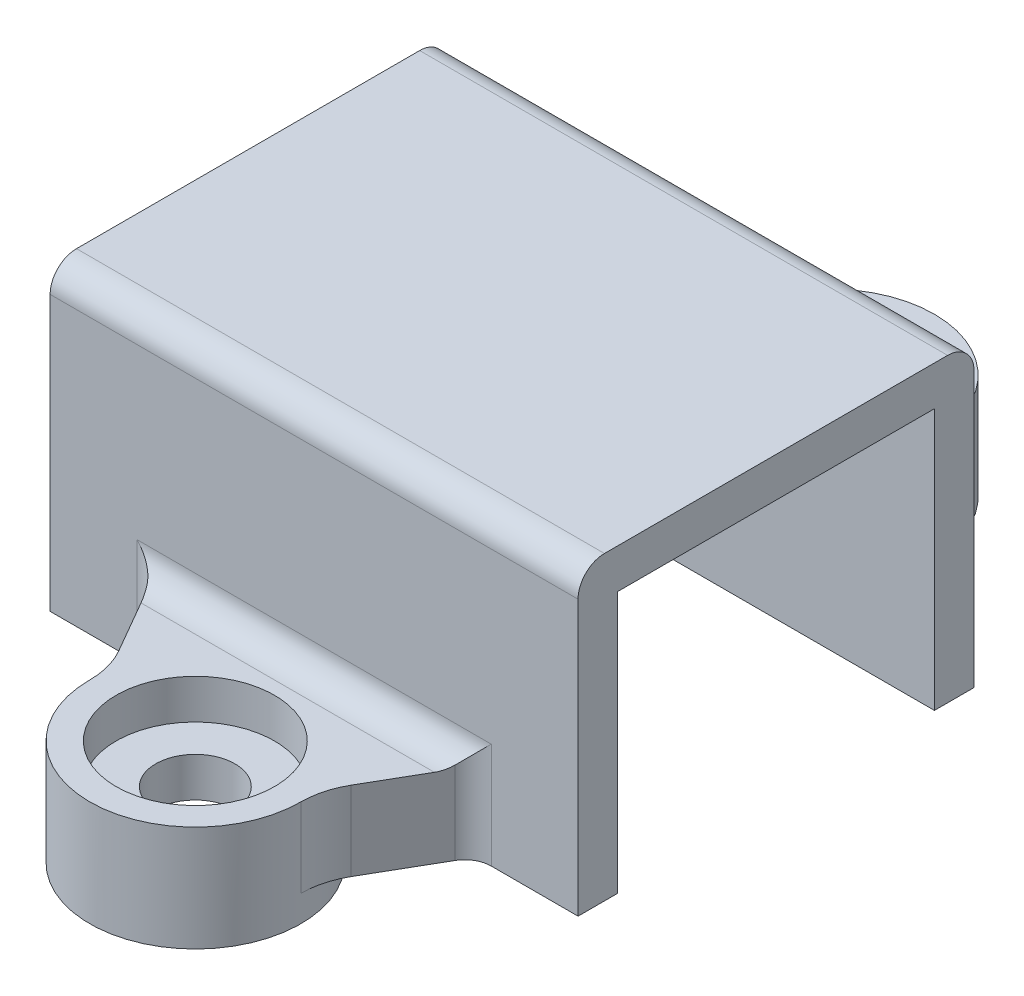
from build123d import *

# Parameters (mm, degrees)
BOSS_EXTRUDE1_DEPTH = 10
SKETCH2_W           = 0.8
SKETCH2_H           = 12
CUT_EXTRUDE1_DEPTH  = 10
SKETCH3_R           = 1.5
BOSS_EXTRUDE2_DEPTH = 3
FILLET1_R           = 1
SKETCH4_R           = 3
CUT_EXTRUDE2_DEPTH  = 1.5
BOSS_EXTRUDE3_START = 1
SKETCH6_R           = 4
SKETCH6_R_2         = 3.05
BOSS_EXTRUDE3_DEPTH = 1


with BuildPart() as part:
    # Sketch1 → Boss-Extrude1 (new, symmetric)
    with BuildSketch(Plane(origin=(0, 0, 0), x_dir=(0, 0, -1), z_dir=(1, 0, 0))):
        with BuildLine():
            Line((-6, 0), (-7.5, 0))
            Line((-7.5, 0), (-7.5, 10.4))
            ThreePointArc((-7.5, 10.4), (-7.207106781, 11.107106781), (-6.5, 11.4))
            Line((-6.5, 11.4), (6.5, 11.4))
            ThreePointArc((6.5, 11.4), (7.207106781, 11.107106781), (7.5, 10.4))
            Line((7.5, 10.4), (7.5, 0))
            Line((7.5, 0), (6, 0))
            Line((6, 0), (6, 7.9))
            ThreePointArc((6, 7.9), (5.414213562, 9.314213562), (4, 9.9))
            Line((4, 9.9), (-4, 9.9))
            ThreePointArc((-4, 9.9), (-5.414213562, 9.314213562), (-6, 7.9))
            Line((-6, 7.9), (-6, 0))
        make_face()
    extrude(amount=BOSS_EXTRUDE1_DEPTH, both=True)

    # Sketch2 → Cut-Extrude1 (cut)
    with BuildSketch(Plane.XZ.offset(-9.9)):
        Polygon((4.9, -6), (4.1, -6), (4.1, 6), (4.9, 6), (11.86883473, 6), (11.86883473, -6), align=None)
        with Locations((1.5, 0)):
            Rectangle(SKETCH2_W, SKETCH2_H)
    extrude(amount=CUT_EXTRUDE1_DEPTH, mode=Mode.SUBTRACT)

    # Sketch3 → Boss-Extrude2 (add)
    # profile 1 of 2: a face of its own
    with BuildSketch(Plane(origin=(0, 0, 0), x_dir=(1, 0, 0), z_dir=(0, 1, 0))):
        with BuildLine():
            Line((-6.133974596, 7.5), (-4.401923789, 10.5))
            ThreePointArc((-4.401923789, 10.5), (-4.102222521, 11.223542865), (-4, 12))
            ThreePointArc((-4, 12), (0, 16), (4, 12))
            ThreePointArc((4, 12), (4.102222521, 11.223542865), (4.401923789, 10.5))
            Line((4.401923789, 10.5), (6.133974596, 7.5))
            Line((6.133974596, 7.5), (-6.133974596, 7.5))
        make_face()
        with Locations(Location((0, 12, 0), (0, 0, 270))):
            Circle(SKETCH3_R, mode=Mode.SUBTRACT)
    # profile 2 of 2: a face of its own
    with BuildSketch(Plane(origin=(0, 0, 0), x_dir=(1, 0, 0), z_dir=(0, 1, 0))):
        with BuildLine():
            Line((6.133974596, -7.5), (4.401923789, -10.5))
            ThreePointArc((4.401923789, -10.5), (4.102222521, -11.223542865), (4, -12))
            ThreePointArc((4, -12), (0, -16), (-4, -12))
            ThreePointArc((-4, -12), (-4.102222521, -11.223542865), (-4.401923789, -10.5))
            Line((-4.401923789, -10.5), (-6.133974596, -7.5))
            Line((-6.133974596, -7.5), (6.133974596, -7.5))
        make_face()
        with Locations(Location((0, -12, 0), (0, 0, 270))):
            Circle(SKETCH3_R, mode=Mode.SUBTRACT)
    extrude(amount=BOSS_EXTRUDE2_DEPTH)

    # Fillet1
    fillet1_edges = [part.edges().sort_by_distance(p)[0] for p in [
        (0, 3, 7.5),
        (6.133974596, 1.5, 7.5),
        (-6.133974596, 1.5, 7.5),
        (0, 3, -7.5),
        (-6.133974596, 1.5, -7.5),
        (6.133974596, 1.5, -7.5),
    ]]
    fillet(fillet1_edges, radius=FILLET1_R)

    # Sketch4 → Cut-Extrude2 (cut)
    with BuildSketch(Plane(origin=(0, 3, 0), x_dir=(1, 0, 0), z_dir=(0, 1, 0))):
        with Locations(Location((0, -12, 0), (0, 0, 270))):
            Circle(SKETCH4_R)
        with Locations(Location((0, 12, 0), (0, 0, 270))):
            Circle(SKETCH4_R)
    extrude(amount=-CUT_EXTRUDE2_DEPTH, mode=Mode.SUBTRACT)

    # Sketch6 → Boss-Extrude3 (add)
    # profile 1 of 2: a face of its own
    with BuildSketch(Plane.XZ.offset(BOSS_EXTRUDE3_START)):
        with Locations(Location((0, 12, 0), (0, 0, 270))):
            Circle(SKETCH6_R)
        with Locations(Location((0, 12, 0), (0, 0, 270))):
            Circle(SKETCH6_R_2, mode=Mode.SUBTRACT)
    # profile 2 of 2: a face of its own
    with BuildSketch(Plane.XZ.offset(BOSS_EXTRUDE3_START)):
        with Locations(Location((0, -12, 0), (0, 0, 270))):
            Circle(SKETCH6_R)
        with Locations(Location((0, -12, 0), (0, 0, 270))):
            Circle(SKETCH6_R_2, mode=Mode.SUBTRACT)
    extrude(amount=-BOSS_EXTRUDE3_DEPTH)


solid = part.part
